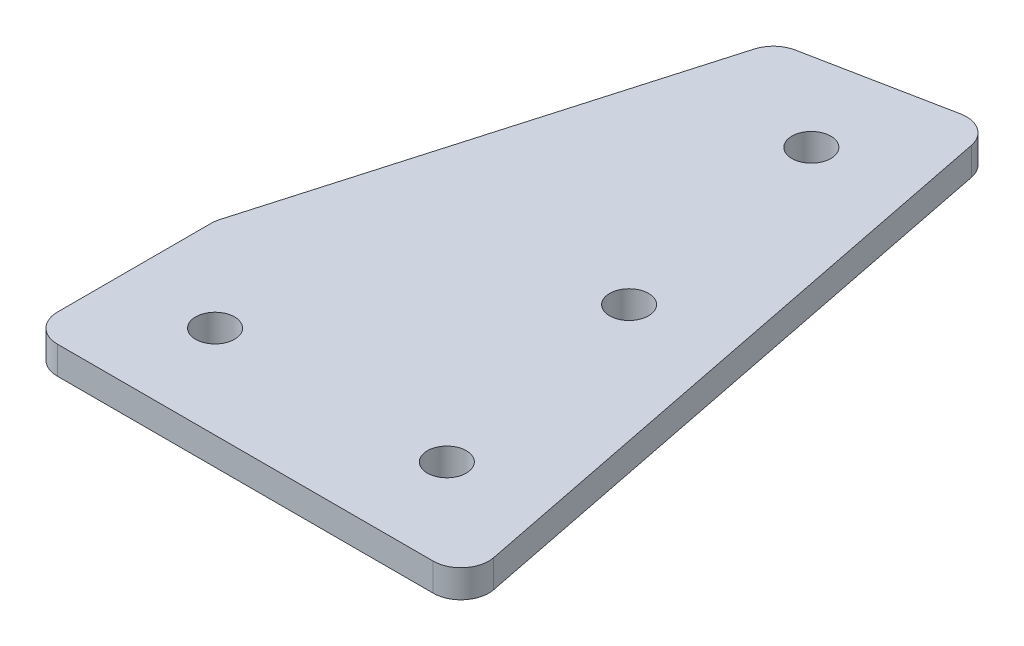
from build123d import *

# Parameters (mm, degrees)
SKETCH_1_R      = 2.1
EXTRUDE_1_DEPTH = 3
FILLET_1_R      = 3


with BuildPart() as part:
    # 草图1 → 凸台-拉伸1 (new body)
    # profile 1 of 3: a face of its own
    with BuildSketch(Plane(origin=(0, 0, 0), x_dir=(1, 0, 0), z_dir=(0, 1, 0))):
        Polygon((-12.178532268, 10), (8.211170098, 10), (-1.865732489, 60.799005274), (-21.48347839, 56.907470127), align=None)
        with Locations(Location((-4.864418933, 24.522182375, 0), (0, 0, 270))):
            Circle(SKETCH_1_R, mode=Mode.SUBTRACT)
        with Locations(Location((-9.728837866, 49.04436475, 0), (0, 0, 270))):
            Circle(SKETCH_1_R, mode=Mode.SUBTRACT)
    # profile 2 of 3: a face of its own
    with BuildSketch(Plane(origin=(0, 0, 0), x_dir=(1, 0, 0), z_dir=(0, 1, 0))):
        Polygon((12.178532268, -10), (8.211170098, 10), (-12.178532268, 10), (-35, 10), (-35, -10), align=None)
        with Locations(Location((-25, 0, 0), (0, 0, 270))):
            Circle(SKETCH_1_R, mode=Mode.SUBTRACT)
        with Locations(Location((0, 0, 0), (0, 0, 270))):
            Circle(SKETCH_1_R, mode=Mode.SUBTRACT)
    # profile 3 of 3: a face of its own
    with BuildSketch(Plane(origin=(0, 0, 0), x_dir=(1, 0, 0), z_dir=(0, 1, 0))):
        Polygon((-35, 10), (-12.178532268, 10), (-21.48347839, 56.907470127), align=None)
    extrude(amount=EXTRUDE_1_DEPTH)

    # 圆角1
    fillet_1_edges = [part.edges().sort_by_distance(p)[0] for p in [
        (12.178532268, 1.5, 10),
        (-35, 1.5, 10),
        (-35, 1.5, -10),
        (-21.48347839, 1.5, -56.907470127),
        (-1.865732489, 1.5, -60.799005274),
    ]]
    fillet(fillet_1_edges, radius=FILLET_1_R)


solid = part.part
